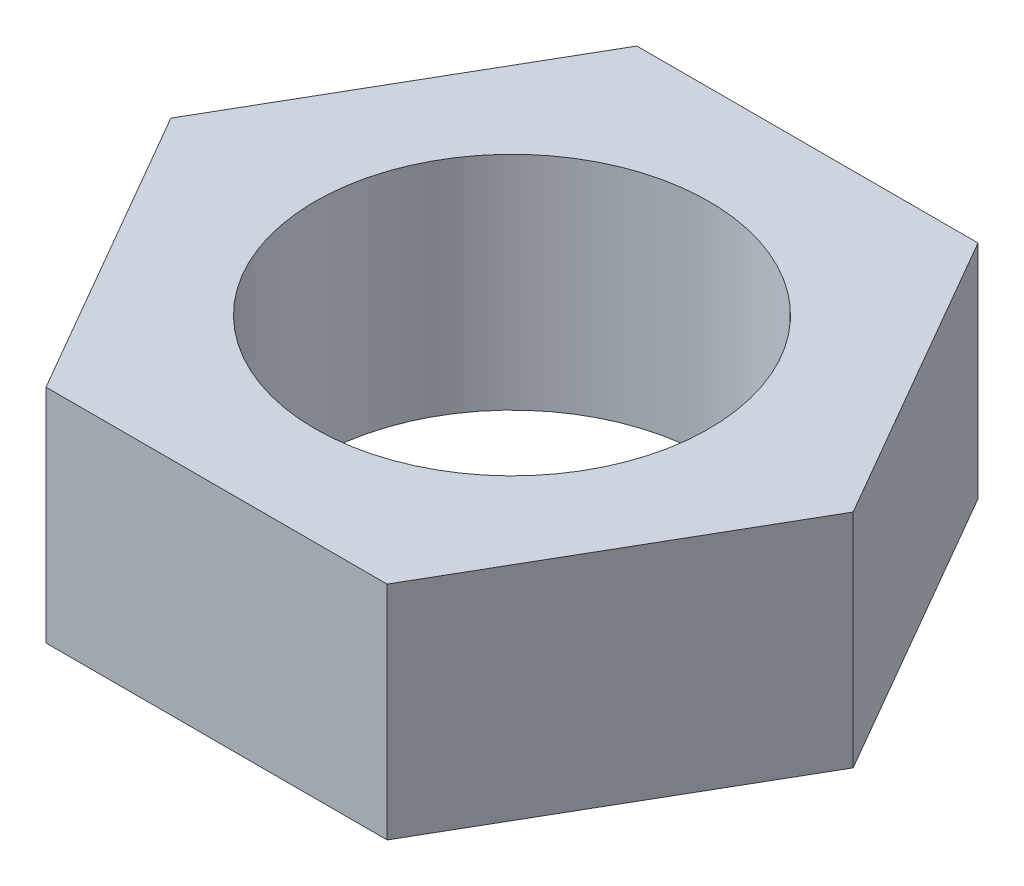
from build123d import *

# Parameters (mm, degrees)
SKETCH1_R      = 9.525
EXTRUDE1_DEPTH = 10.715625


with BuildPart() as part:
    # Sketch1 → Extrude1 (new body)
    with BuildSketch(Plane(origin=(0, 0, 0), x_dir=(1, 0, 0), z_dir=(0, 1, 0))):
        Polygon((8.248891971, 14.2875), (-8.248891971, 14.2875), (-16.497783942, 0), (-8.248891971, -14.2875), (8.248891971, -14.2875), (16.497783942, 0), align=None)
        with Locations(Location((0, 0, 0), (0, 0, 270))):
            Circle(SKETCH1_R, mode=Mode.SUBTRACT)
    extrude(amount=EXTRUDE1_DEPTH)


solid = part.part
